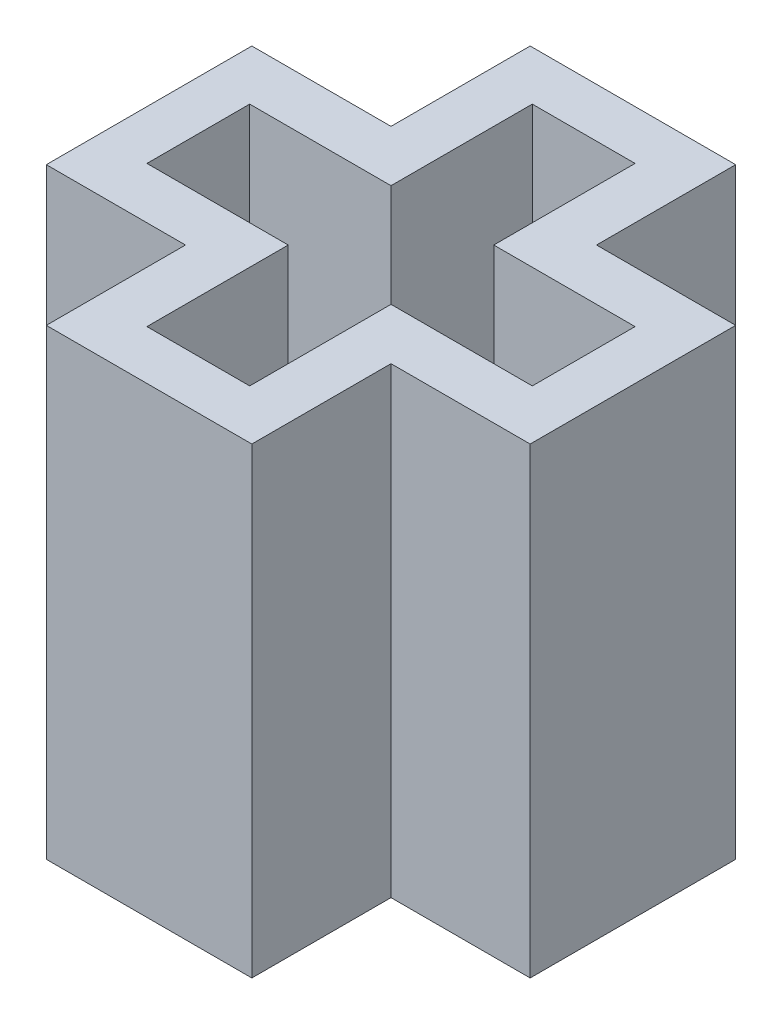
from build123d import *

# Parameters (mm, degrees)
BOSS_EXTRUDE1_DEPTH = 5.4


with BuildPart() as part:
    # Sketch1 → Boss-Extrude1 (new body)
    with BuildSketch(Plane(origin=(0, 0, 0), x_dir=(1, 0, 0), z_dir=(0, 1, 0))):
        Polygon((1.2, 2.825), (-1.2, 2.825), (-1.2, 1.2), (-2.825, 1.2), (-2.825, -1.2), (-1.2, -1.2), (-1.2, -2.825), (1.2, -2.825), (1.2, -1.2), (2.825, -1.2), (2.825, 1.2), (1.2, 1.2), align=None)
        Polygon((-0.6, 0.6), (-0.6, 2.25), (0.6, 2.25), (0.6, 0.6), (2.25, 0.6), (2.25, -0.6), (0.6, -0.6), (0.6, -2.25), (-0.6, -2.25), (-0.6, -0.6), (-2.25, -0.6), (-2.25, 0.6), align=None, mode=Mode.SUBTRACT)
    extrude(amount=BOSS_EXTRUDE1_DEPTH)


solid = part.part
